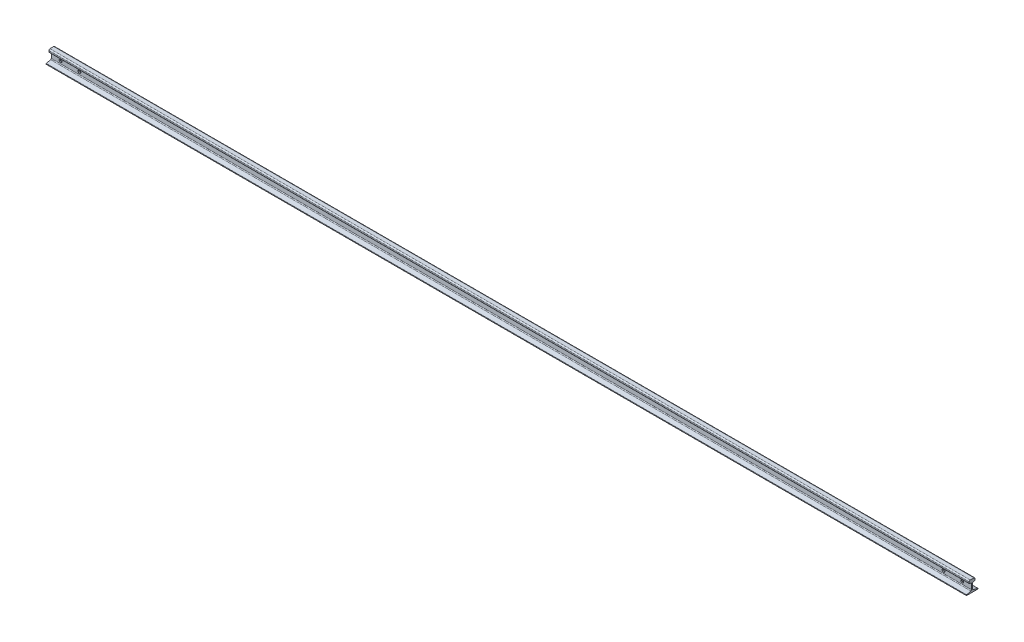
from build123d import *

# Parameters (mm, degrees)
BASE_DEPTH         = 5000
FILLET1_R          = 6.35
FILLET2_R          = 4.76
FILLET3_R          = 1.59
SKETCH2_R          = 8
CUT_EXTRUDE1_DEPTH = 4584.729758915


with BuildPart() as part:
    # Sketch1 → Base (new body)
    with BuildSketch(Plane(origin=(0, 0, 0), x_dir=(0, 0, -1), z_dir=(1, 0, 0))):
        with BuildLine():
            Line((16.05, 63.077130383), (16.05, 49.044373304))
            Line((16.05, 49.044373304), (2.95, 46.02))
            Line((2.95, 46.02), (2.95, 10.3))
            Line((2.95, 10.3), (31.75, 3.650996096))
            Line((31.75, 3.650996096), (31.75, 0))
            Line((31.75, 0), (-31.75, 0))
            Line((-31.75, 0), (-31.75, 3.650996096))
            Line((-31.75, 3.650996096), (-2.95, 10.3))
            Line((-2.95, 10.3), (-2.95, 46.02))
            Line((-2.95, 46.02), (-16.05, 49.044373304))
            Line((-16.05, 49.044373304), (-16.05, 63.077130383))
            ThreePointArc((-16.05, 63.077130383), (0, 63.5), (16.05, 63.077130383))
        make_face()
    extrude(amount=BASE_DEPTH)

    # Fillet1
    fillet1_edges = [part.edges().sort_by_distance(p)[0] for p in [
        (2500, 63.077130383, -16.05),
        (2500, 63.077130383, 16.05),
    ]]
    fillet(fillet1_edges, radius=FILLET1_R)

    # Fillet2
    fillet2_edges = [part.edges().sort_by_distance(p)[0] for p in [
        (2500, 46.02, -2.95),
        (2500, 10.3, -2.95),
        (2500, 10.3, 2.95),
        (2500, 46.02, 2.95),
    ]]
    fillet(fillet2_edges, radius=FILLET2_R)

    # Fillet3
    fillet3_edges = [part.edges().sort_by_distance(p)[0] for p in [
        (2500, 49.044373304, -16.05),
        (2500, 3.650996096, -31.75),
        (2500, 0, -31.75),
        (2500, 0, 31.75),
        (2500, 3.650996096, 31.75),
        (2500, 49.044373304, 16.05),
    ]]
    fillet(fillet3_edges, radius=FILLET3_R)

    # Sketch2 → Cut-Extrude1 (cut, through all)
    with BuildSketch(Plane(origin=(416.890903054, -3.473265232, 2.95), x_dir=(1, 0, 0), z_dir=(0, 0, 1))):
        with Locations((-366.090903054, 31.472237749)):
            Circle(SKETCH2_R)
        with Locations((-264.490903054, 31.472237749)):
            Circle(SKETCH2_R)
        with Locations((4430.709096946, 31.472237749)):
            Circle(SKETCH2_R)
        with Locations((4532.309096946, 31.472237749)):
            Circle(SKETCH2_R)
    extrude(amount=-CUT_EXTRUDE1_DEPTH, mode=Mode.SUBTRACT)


solid = part.part
